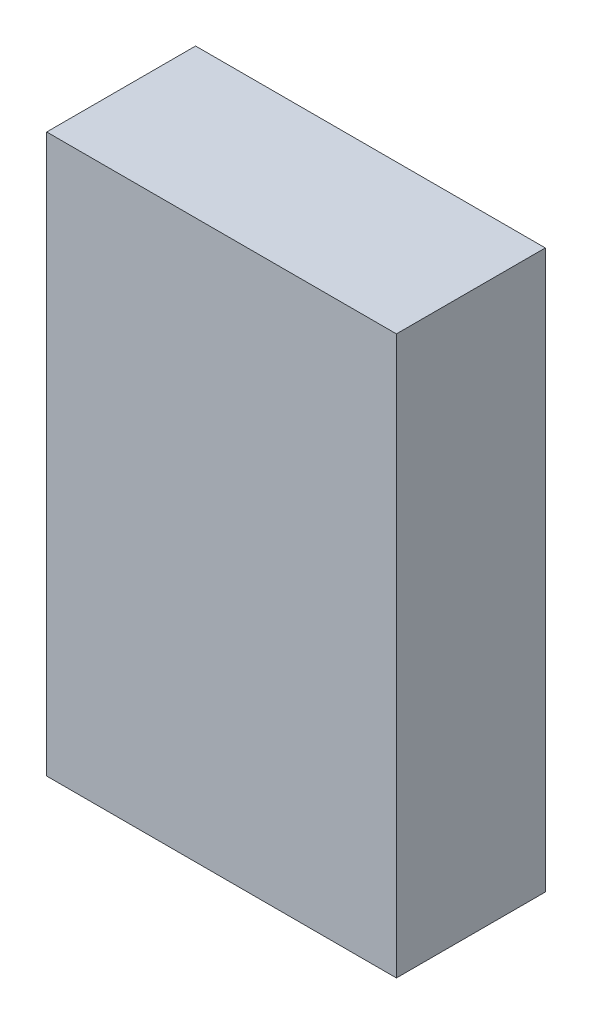
from build123d import *

# Parameters (mm, degrees)
SKETCH1_W      = 20.2
SKETCH1_H      = 32.22
ENVELOPE_DEPTH = 8.6


with BuildPart() as part:
    # Sketch1 → Envelope (new body)
    with BuildSketch(Plane.XY):
        Rectangle(SKETCH1_W, SKETCH1_H)
    extrude(amount=ENVELOPE_DEPTH)


solid = part.part
